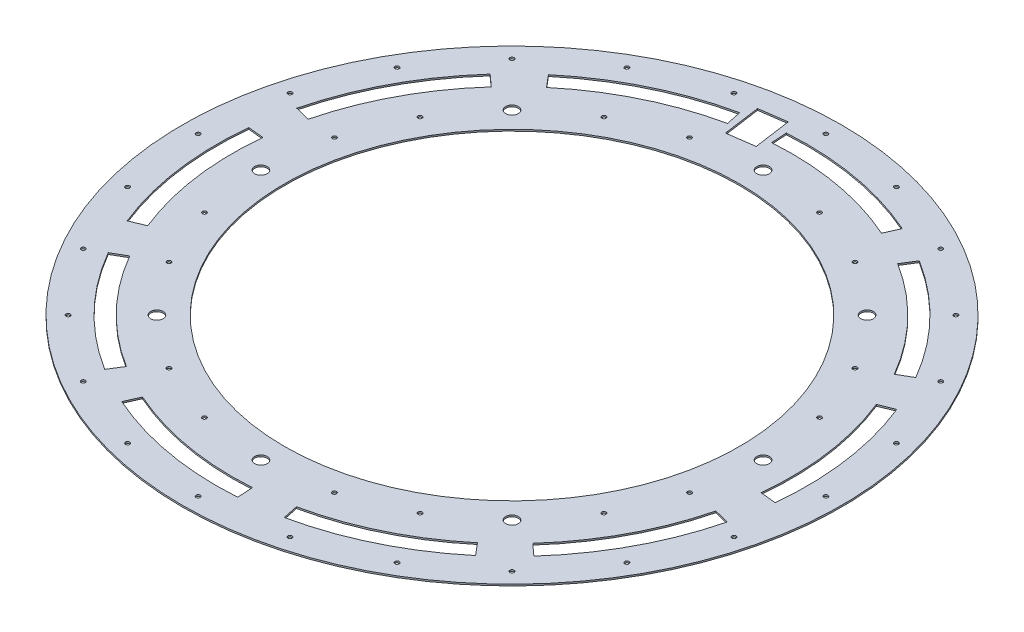
from build123d import *

# Parameters (mm, degrees)
SKETCH1_R           = 315
SKETCH1_R_2         = 217.5
SKETCH1_R_3         = 6
SKETCH1_R_4         = 2
BOSS_EXTRUDE1_DEPTH = 0.75


with BuildPart() as part:
    # Sketch1 → Boss-Extrude1 (new, symmetric)
    with BuildSketch(Plane(origin=(0, 0, 0), x_dir=(1, 0, 0), z_dir=(0, 1, 0))):
        with Locations(Location((0, 0, 0), (0, 0, 270))):
            Circle(SKETCH1_R)
        with Locations(Location((0, 0, 0), (0, 0, 270))):
            Circle(SKETCH1_R_2, mode=Mode.SUBTRACT)
        with Locations(Location((0, 240, 0), (0, 0, 270))):
            Circle(SKETCH1_R_3, mode=Mode.SUBTRACT)
        with Locations(Location((169.705627485, 169.705627485, 0), (0, 0, 270))):
            Circle(SKETCH1_R_3, mode=Mode.SUBTRACT)
        with Locations(Location((240, 0, 0), (0, 0, 270))):
            Circle(SKETCH1_R_3, mode=Mode.SUBTRACT)
        with Locations(Location((169.705627485, -169.705627485, 0), (0, 0, 270))):
            Circle(SKETCH1_R_3, mode=Mode.SUBTRACT)
        with Locations(Location((0, -240, 0), (0, 0, 270))):
            Circle(SKETCH1_R_3, mode=Mode.SUBTRACT)
        with Locations(Location((-169.705627485, -169.705627485, 0), (0, 0, 270))):
            Circle(SKETCH1_R_3, mode=Mode.SUBTRACT)
        with Locations(Location((-240, 0, 0), (0, 0, 270))):
            Circle(SKETCH1_R_3, mode=Mode.SUBTRACT)
        with Locations(Location((-169.705627485, 169.705627485, 0), (0, 0, 270))):
            Circle(SKETCH1_R_3, mode=Mode.SUBTRACT)
        with Locations(Location((-231.822198309, 62.116570825, 0), (0, 0, 270))):
            Circle(SKETCH1_R_4, mode=Mode.SUBTRACT)
        with Locations(Location((-207.846062834, 120.000258819, 0), (0, 0, 270))):
            Circle(SKETCH1_R_4, mode=Mode.SUBTRACT)
        with Locations(Location((-119.999707107, 207.846804015, 0), (0, 0, 270))):
            Circle(SKETCH1_R_4, mode=Mode.SUBTRACT)
        with Locations(Location((-62.116070825, 231.823064335, 0), (0, 0, 270))):
            Circle(SKETCH1_R_4, mode=Mode.SUBTRACT)
        with Locations(Location((62.117570825, 231.823198309, 0), (0, 0, 270))):
            Circle(SKETCH1_R_4, mode=Mode.SUBTRACT)
        with Locations(Location((120.001258819, 207.847062834, 0), (0, 0, 270))):
            Circle(SKETCH1_R_4, mode=Mode.SUBTRACT)
        with Locations(Location((207.847804015, 120.000707107, 0), (0, 0, 270))):
            Circle(SKETCH1_R_4, mode=Mode.SUBTRACT)
        with Locations(Location((231.824064335, 62.117070825, 0), (0, 0, 270))):
            Circle(SKETCH1_R_4, mode=Mode.SUBTRACT)
        with Locations(Location((231.824198309, -62.116570825, 0), (0, 0, 270))):
            Circle(SKETCH1_R_4, mode=Mode.SUBTRACT)
        with Locations(Location((207.848062834, -120.000258819, 0), (0, 0, 270))):
            Circle(SKETCH1_R_4, mode=Mode.SUBTRACT)
        with Locations(Location((120.001707107, -207.846804015, 0), (0, 0, 270))):
            Circle(SKETCH1_R_4, mode=Mode.SUBTRACT)
        with Locations(Location((62.118070825, -231.823064335, 0), (0, 0, 270))):
            Circle(SKETCH1_R_4, mode=Mode.SUBTRACT)
        with Locations(Location((-62.115570825, -231.823198309, 0), (0, 0, 270))):
            Circle(SKETCH1_R_4, mode=Mode.SUBTRACT)
        with Locations(Location((-119.999258819, -207.847062834, 0), (0, 0, 270))):
            Circle(SKETCH1_R_4, mode=Mode.SUBTRACT)
        with Locations(Location((-207.845804015, -120.000707107, 0), (0, 0, 270))):
            Circle(SKETCH1_R_4, mode=Mode.SUBTRACT)
        with Locations(Location((-231.822064335, -62.117070825, 0), (0, 0, 270))):
            Circle(SKETCH1_R_4, mode=Mode.SUBTRACT)
        with Locations(Location((-289.777747887, 77.645713531, 0), (0, 0, 270))):
            Circle(SKETCH1_R_4, mode=Mode.SUBTRACT)
        with Locations(Location((-259.807621135, 150, 0), (0, 0, 270))):
            Circle(SKETCH1_R_4, mode=Mode.SUBTRACT)
        with Locations(Location((-212.132034356, 212.132034356, 0), (0, 0, 270))):
            Circle(SKETCH1_R_4, mode=Mode.SUBTRACT)
        with Locations(Location((-150, 259.807621135, 0), (0, 0, 270))):
            Circle(SKETCH1_R_4, mode=Mode.SUBTRACT)
        with Locations(Location((-77.645713531, 289.777747887, 0), (0, 0, 270))):
            Circle(SKETCH1_R_4, mode=Mode.SUBTRACT)
        with Locations(Location((0, 300, 0), (0, 0, 270))):
            Circle(SKETCH1_R_4, mode=Mode.SUBTRACT)
        with Locations(Location((77.645713531, 289.777747887, 0), (0, 0, 270))):
            Circle(SKETCH1_R_4, mode=Mode.SUBTRACT)
        with Locations(Location((150, 259.807621135, 0), (0, 0, 270))):
            Circle(SKETCH1_R_4, mode=Mode.SUBTRACT)
        with Locations(Location((212.132034356, 212.132034356, 0), (0, 0, 270))):
            Circle(SKETCH1_R_4, mode=Mode.SUBTRACT)
        with Locations(Location((259.807621135, 150, 0), (0, 0, 270))):
            Circle(SKETCH1_R_4, mode=Mode.SUBTRACT)
        with Locations(Location((289.777747887, 77.645713531, 0), (0, 0, 270))):
            Circle(SKETCH1_R_4, mode=Mode.SUBTRACT)
        with Locations(Location((300, 0, 0), (0, 0, 270))):
            Circle(SKETCH1_R_4, mode=Mode.SUBTRACT)
        with Locations(Location((289.777747887, -77.645713531, 0), (0, 0, 270))):
            Circle(SKETCH1_R_4, mode=Mode.SUBTRACT)
        with Locations(Location((259.807621135, -150, 0), (0, 0, 270))):
            Circle(SKETCH1_R_4, mode=Mode.SUBTRACT)
        with Locations(Location((212.132034356, -212.132034356, 0), (0, 0, 270))):
            Circle(SKETCH1_R_4, mode=Mode.SUBTRACT)
        with Locations(Location((150, -259.807621135, 0), (0, 0, 270))):
            Circle(SKETCH1_R_4, mode=Mode.SUBTRACT)
        with Locations(Location((77.645713531, -289.777747887, 0), (0, 0, 270))):
            Circle(SKETCH1_R_4, mode=Mode.SUBTRACT)
        with Locations(Location((0, -300, 0), (0, 0, 270))):
            Circle(SKETCH1_R_4, mode=Mode.SUBTRACT)
        with Locations(Location((-77.645713531, -289.777747887, 0), (0, 0, 270))):
            Circle(SKETCH1_R_4, mode=Mode.SUBTRACT)
        with Locations(Location((-150, -259.807621135, 0), (0, 0, 270))):
            Circle(SKETCH1_R_4, mode=Mode.SUBTRACT)
        with Locations(Location((-212.132034356, -212.132034356, 0), (0, 0, 270))):
            Circle(SKETCH1_R_4, mode=Mode.SUBTRACT)
        with Locations(Location((-259.807621135, -150, 0), (0, 0, 270))):
            Circle(SKETCH1_R_4, mode=Mode.SUBTRACT)
        with Locations(Location((-289.777747887, -77.645713531, 0), (0, 0, 270))):
            Circle(SKETCH1_R_4, mode=Mode.SUBTRACT)
        with Locations(Location((-300, 0, 0), (0, 0, 270))):
            Circle(SKETCH1_R_4, mode=Mode.SUBTRACT)
        Polygon((-53.651203475, 288.339293829), (-27.904233688, 291.957794454), (-22.894002053, 256.308143979), (-48.64097184, 252.689643354), align=None, mode=Mode.SUBTRACT)
        with BuildLine():
            Line((-19.708603347, 281.846158847), (-18.659856727, 266.848383445))
            ThreePointArc((-18.659856727, 266.848383445), (46.450887526, 263.436073931), (108.802052023, 244.373409919))
            Line((108.802052023, 244.373409919), (114.917092776, 258.108016324))
            ThreePointArc((114.917092776, 258.108016324), (49.061583418, 278.242066078), (-19.708603347, 281.846158847))
        make_face(mode=Mode.SUBTRACT)
        with BuildLine():
            Line((231.661795512, 133.75), (244.681966494, 141.267199221))
            ThreePointArc((244.681966494, 141.267199221), (203.238237764, 196.26488482), (149.720420543, 239.602758697))
            Line((149.720420543, 239.602758697), (141.753403182, 226.852865722))
            ThreePointArc((141.753403182, 226.852865722), (192.423396591, 185.821114098), (231.661795512, 133.75))
        make_face(mode=Mode.SUBTRACT)
        with BuildLine():
            Line((266.034607011, -27.961363924), (280.986645445, -29.532886489))
            ThreePointArc((280.986645445, -29.532886489), (279.784793098, 39.321188359), (261.961332595, 105.839248523))
            Line((261.961332595, 105.839248523), (248.021681097, 100.207263739))
            ThreePointArc((248.021681097, 100.207263739), (264.896708388, 37.228804507), (266.034607011, -27.961363924))
        make_face(mode=Mode.SUBTRACT)
        with BuildLine():
            Line((198.791240815, -178.992437201), (209.963976221, -189.052413347))
            ThreePointArc((209.963976221, -189.052413347), (249.463067004, -132.641865577), (274.141919334, -68.351257243))
            Line((274.141919334, -68.351257243), (259.554106779, -64.714107073))
            ThreePointArc((259.554106779, -64.714107073), (236.18848109, -125.583643045), (198.791240815, -178.992437201))
        make_face(mode=Mode.SUBTRACT)
        with BuildLine():
            Line((55.616377294, -261.654483196), (58.742204494, -276.360343961))
            ThreePointArc((58.742204494, -276.360343961), (123.854928252, -253.940235194), (181.609610629, -216.433905916))
            Line((181.609610629, -216.433905916), (171.945685591, -204.916888534))
            ThreePointArc((171.945685591, -204.916888534), (117.264281766, -240.427407385), (55.616377294, -261.654483196))
        make_face(mode=Mode.SUBTRACT)
        with BuildLine():
            Line((-108.802052023, -244.373409919), (-114.917092776, -258.108016324))
            ThreePointArc((-114.917092776, -258.108016324), (-49.061583418, -278.242066078), (19.708603347, -281.846158847))
            Line((19.708603347, -281.846158847), (18.659856727, -266.848383445))
            ThreePointArc((18.659856727, -266.848383445), (-46.450887526, -263.436073931), (-108.802052023, -244.373409919))
        make_face(mode=Mode.SUBTRACT)
        with BuildLine():
            Line((-231.661795512, -133.75), (-244.681966494, -141.267199221))
            ThreePointArc((-244.681966494, -141.267199221), (-203.238237764, -196.26488482), (-149.720420543, -239.602758697))
            Line((-149.720420543, -239.602758697), (-141.753403182, -226.852865722))
            ThreePointArc((-141.753403182, -226.852865722), (-192.423396591, -185.821114098), (-231.661795512, -133.75))
        make_face(mode=Mode.SUBTRACT)
        with BuildLine():
            Line((-266.034607011, 27.961363924), (-280.986645445, 29.532886489))
            ThreePointArc((-280.986645445, 29.532886489), (-279.784793098, -39.321188359), (-261.961332595, -105.839248523))
            Line((-261.961332595, -105.839248523), (-248.021681097, -100.207263739))
            ThreePointArc((-248.021681097, -100.207263739), (-264.896708388, -37.228804507), (-266.034607011, 27.961363924))
        make_face(mode=Mode.SUBTRACT)
        with BuildLine():
            Line((-198.791240815, 178.992437201), (-209.963976221, 189.052413347))
            ThreePointArc((-209.963976221, 189.052413347), (-249.463067004, 132.641865577), (-274.141919334, 68.351257243))
            Line((-274.141919334, 68.351257243), (-259.554106779, 64.714107073))
            ThreePointArc((-259.554106779, 64.714107073), (-236.18848109, 125.583643045), (-198.791240815, 178.992437201))
        make_face(mode=Mode.SUBTRACT)
        with BuildLine():
            Line((-55.616377294, 261.654483196), (-58.742204494, 276.360343961))
            ThreePointArc((-58.742204494, 276.360343961), (-123.854928252, 253.940235194), (-181.609610629, 216.433905916))
            Line((-181.609610629, 216.433905916), (-171.945685591, 204.916888534))
            ThreePointArc((-171.945685591, 204.916888534), (-117.264281766, 240.427407385), (-55.616377294, 261.654483196))
        make_face(mode=Mode.SUBTRACT)
    extrude(amount=BOSS_EXTRUDE1_DEPTH, both=True)


solid = part.part
